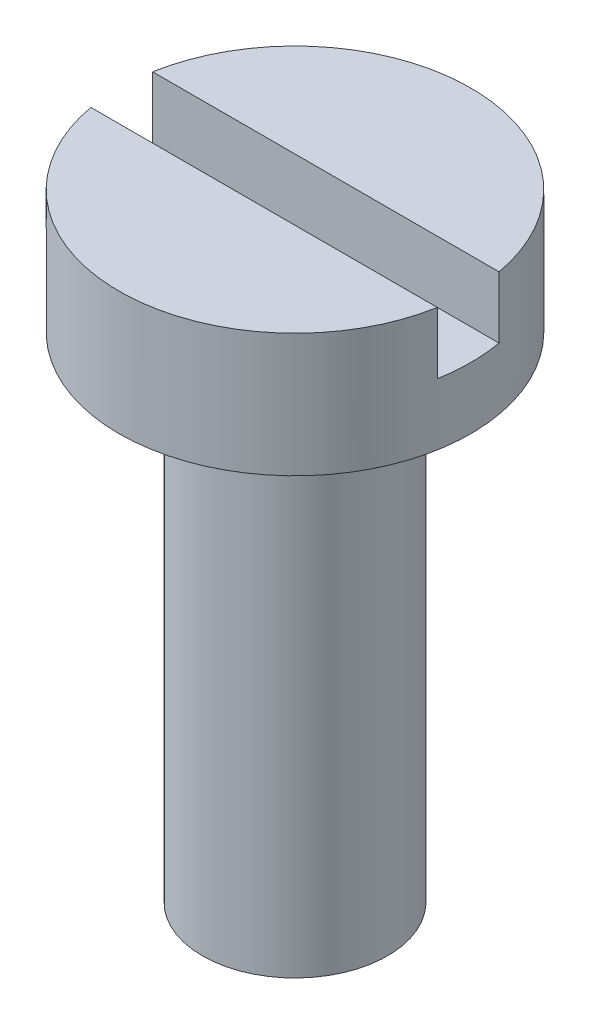
from build123d import *

# Parameters (mm, degrees)
SKETCH1_R           = 2.85
BOSS_EXTRUDE1_DEPTH = 2
SKETCH2_R           = 1.5
BOSS_EXTRUDE2_DEPTH = 8
SKETCH3_W           = 6
SKETCH3_H           = 1
CUT_EXTRUDE1_DEPTH  = 1


with BuildPart() as part:
    # Sketch1 → Boss-Extrude1 (new body)
    with BuildSketch(Plane(origin=(0, 0, 0), x_dir=(1, 0, 0), z_dir=(0, 1, 0))):
        with Locations(Location((0, 0, 0), (0, 0, 270))):
            Circle(SKETCH1_R)
    extrude(amount=BOSS_EXTRUDE1_DEPTH)

    # Sketch2 → Boss-Extrude2 (add)
    with BuildSketch(Plane(origin=(0, 0, 0), x_dir=(1, 0, 0), z_dir=(0, 1, 0))):
        with Locations(Location((0, 0, 0), (0, 0, 270))):
            Circle(SKETCH2_R)
    extrude(amount=-BOSS_EXTRUDE2_DEPTH)

    # Sketch3 → Cut-Extrude1 (cut)
    with BuildSketch(Plane(origin=(0, 2, 0), x_dir=(1, 0, 0), z_dir=(0, 1, 0))):
        Rectangle(SKETCH3_W, SKETCH3_H)
    extrude(amount=-CUT_EXTRUDE1_DEPTH, mode=Mode.SUBTRACT)


solid = part.part
